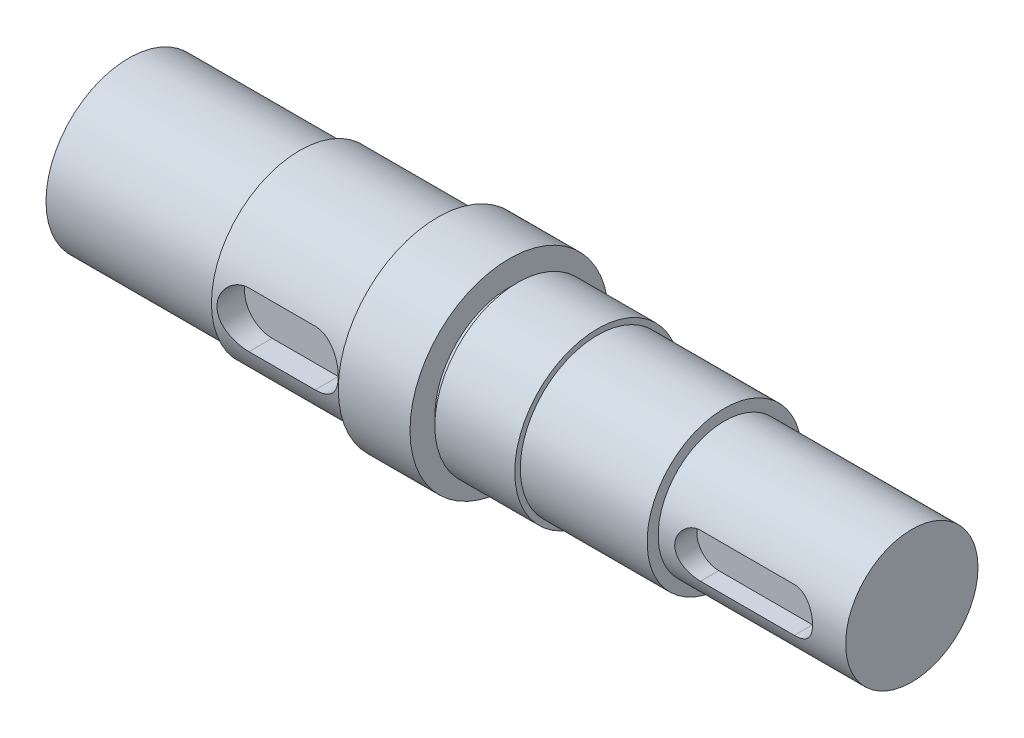
from build123d import *

# Parameters (mm, degrees)
SKETCH_1_R          = 18
EXTRUDE_1_DEPTH     = 13
SKETCH_2_R          = 13.5
EXTRUDE_2_DEPTH     = 1.5
SKETCH_3_R          = 15
EXTRUDE_3_DEPTH     = 14.5
SKETCH_4_R          = 14
EXTRUDE_4_DEPTH     = 23
SKETCH_5_R          = 12
EXTRUDE_5_DEPTH     = 34
SKETCH_6_R          = 16
EXTRUDE_6_DEPTH     = 25
EXTRUDE_START       = 31
SKETCH_7_R          = 15
EXTRUDE_7_DEPTH     = 31
CUT_EXTRUDE_START   = 11
CUT_EXTRUDE_1_DEPTH = 31
CUT_EXTRUDE_START_2 = 8
CUT_EXTRUDE_2_DEPTH = 31


with BuildPart() as part:
    # 草图1 → 凸台-拉伸1 (new body)
    with BuildSketch(Plane(origin=(0, 0, 0), x_dir=(0, 0, -1), z_dir=(1, 0, 0))):
        with Locations(Location((0, 0, 0), (0, 0, 180))):
            Circle(SKETCH_1_R)
    extrude(amount=EXTRUDE_1_DEPTH)

    # 草图2 → 凸台-拉伸2 (add)
    with BuildSketch(Plane(origin=(13, 0, 0), x_dir=(0, 0, -1), z_dir=(1, 0, 0))):
        Circle(SKETCH_2_R)
    extrude(amount=EXTRUDE_2_DEPTH)

    # 草图3 → 凸台-拉伸3 (add)
    with BuildSketch(Plane(origin=(14.5, 0, 0), x_dir=(0, 0, -1), z_dir=(1, 0, 0))):
        with Locations(Location((0, 0, 0), (0, 0, 180))):
            Circle(SKETCH_3_R)
    extrude(amount=EXTRUDE_3_DEPTH)

    # 草图4 → 凸台-拉伸4 (add)
    with BuildSketch(Plane(origin=(29, 0, 0), x_dir=(0, 0, -1), z_dir=(1, 0, 0))):
        Circle(SKETCH_4_R)
    extrude(amount=EXTRUDE_4_DEPTH)

    # 草图5 → 凸台-拉伸5 (add)
    with BuildSketch(Plane(origin=(52, 0, 0), x_dir=(0, 0, -1), z_dir=(1, 0, 0))):
        Circle(SKETCH_5_R)
    extrude(amount=EXTRUDE_5_DEPTH)

    # 草图6 → 凸台-拉伸6 (add)
    with BuildSketch(Plane.ZY):
        with Locations(Location((0, 0, 0), (0, 0, 180))):
            Circle(SKETCH_6_R)
    extrude(amount=EXTRUDE_6_DEPTH)

    # 草图7 → 凸台-拉伸7 (add)
    with BuildSketch(Plane.ZY.offset(25).offset(EXTRUDE_START)):
        Circle(SKETCH_7_R)
    extrude(amount=-EXTRUDE_7_DEPTH)

    # 草图8 → 切除-拉伸1 (cut)
    with BuildSketch(Plane.XY.offset(CUT_EXTRUDE_START)):
        with BuildLine():
            Line((-19, -5), (-7, -5))
            ThreePointArc((-7, -5), (-2, 0), (-7, 5))
            Line((-7, 5), (-19, 5))
            ThreePointArc((-19, 5), (-24, 0), (-19, -5))
        make_face()
    extrude(amount=CUT_EXTRUDE_1_DEPTH, mode=Mode.SUBTRACT)

    # 草图9 → 切除-拉伸2 (cut)
    with BuildSketch(Plane.XY.offset(CUT_EXTRUDE_START_2)):
        with BuildLine():
            Line((59, -4), (76, -4))
            ThreePointArc((76, -4), (80, 0), (76, 4))
            Line((76, 4), (59, 4))
            ThreePointArc((59, 4), (55, 0), (59, -4))
        make_face()
    extrude(amount=CUT_EXTRUDE_2_DEPTH, mode=Mode.SUBTRACT)


solid = part.part
